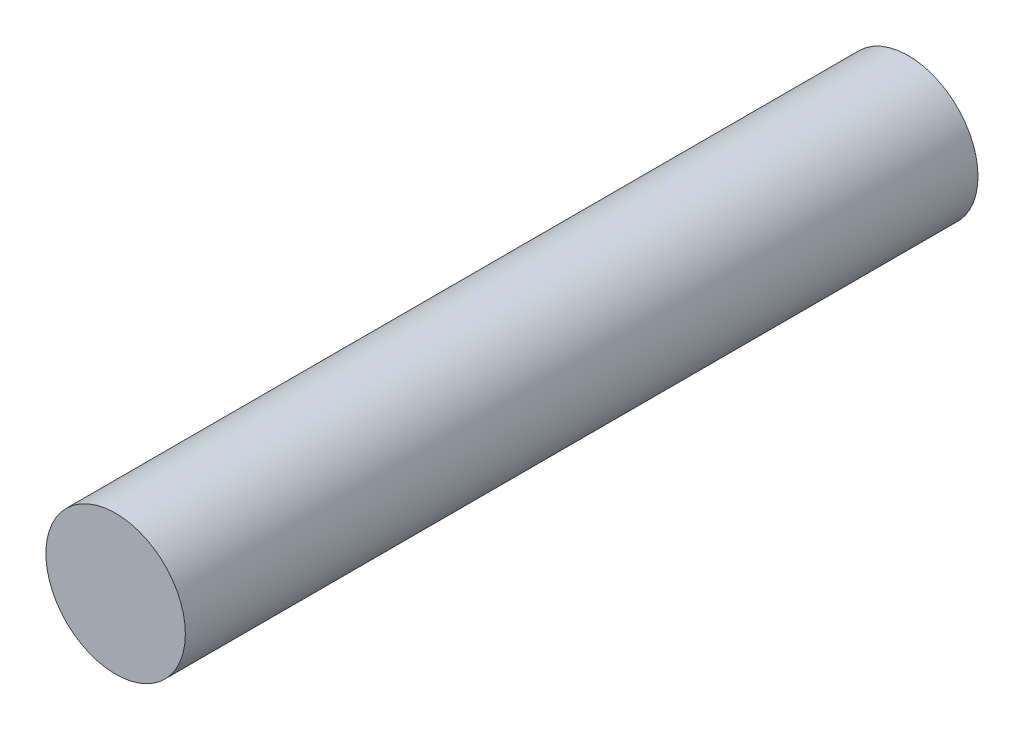
from build123d import *

# Parameters (mm, degrees)
ESQUISSE1_R        = 22
BOSS_EXTRU_1_DEPTH = 250


with BuildPart() as part:
    # Esquisse1 → Boss.-Extru.1 (new body)
    with BuildSketch(Plane.XY):
        Circle(ESQUISSE1_R)
    extrude(amount=BOSS_EXTRU_1_DEPTH)


solid = part.part
